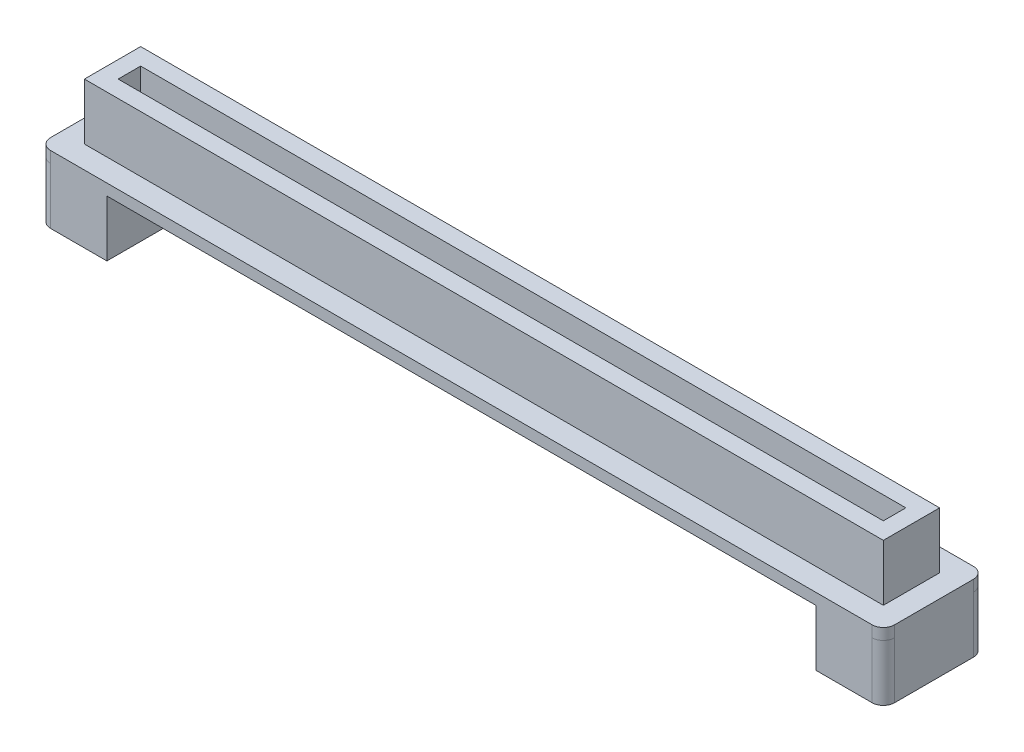
from build123d import *

# Parameters (mm, degrees)
SKETCH1_W           = 75
SKETCH1_H           = 9
BOSS_EXTRUDE1_DEPTH = 1
FILLET1_R           = 1
SKETCH8_W           = 71
SKETCH8_H           = 5
BOSS_EXTRUDE2_DEPTH = 6
SHELL1_T            = -1.5
SKETCH9_W           = 6
SKETCH9_H           = 9
BOSS_EXTRUDE3_DEPTH = 5
LPATTERN1_COUNT     = 2
LPATTERN1_PITCH     = 69
FILLET2_R           = 1


with BuildPart() as part:
    # Sketch1 → Boss-Extrude1 (new body)
    with BuildSketch(Plane(origin=(0, 0, 0), x_dir=(1, 0, 0), z_dir=(0, 1, 0))):
        with Locations((37.5, 4.5)):
            Rectangle(SKETCH1_W, SKETCH1_H)
    extrude(amount=BOSS_EXTRUDE1_DEPTH)

    # Fillet1
    fillet1_edges = [part.edges().sort_by_distance(p)[0] for p in [
        (0, 0.5, -9),
        (75, 0.5, -9),
        (75, 0.5, 0),
        (0, 0.5, 0),
    ]]
    fillet(fillet1_edges, radius=FILLET1_R)

    # Sketch8 → Boss-Extrude2 (add)
    with BuildSketch(Plane(origin=(0, 0, 0), x_dir=(1, 0, 0), z_dir=(0, 1, 0))):
        with Locations((37.5, 4.5)):
            Rectangle(SKETCH8_W, SKETCH8_H)
    extrude(amount=BOSS_EXTRUDE2_DEPTH)

    # Shell1
    shell1_openings = [part.faces().sort_by_distance(p)[0] for p in [
        (37.5, 6, -4.5),
    ]]
    offset(amount=SHELL1_T, openings=shell1_openings, kind=Kind.INTERSECTION)

    # Sketch9 → Boss-Extrude3 (add)
    with BuildSketch(Plane(origin=(0, 0, 0), x_dir=(-1, 0, 0), z_dir=(0, -1, 0))):
        with Locations((-3, 4.5)):
            Rectangle(SKETCH9_W, SKETCH9_H)
    boss_extrude3 = extrude(amount=BOSS_EXTRUDE3_DEPTH)

    # LPattern1: Boss-Extrude3 ×2
    with Locations(*[(i * LPATTERN1_PITCH, 0, 0) for i in range(1, LPATTERN1_COUNT)]):
        add(boss_extrude3)

    # Fillet2
    fillet2_edges = [part.edges().sort_by_distance(p)[0] for p in [
        (0, -2.5, 0),
        (0, -2.5, -9),
        (75, -2.5, -9),
        (75, -2.5, 0),
    ]]
    fillet(fillet2_edges, radius=FILLET2_R)


solid = part.part
